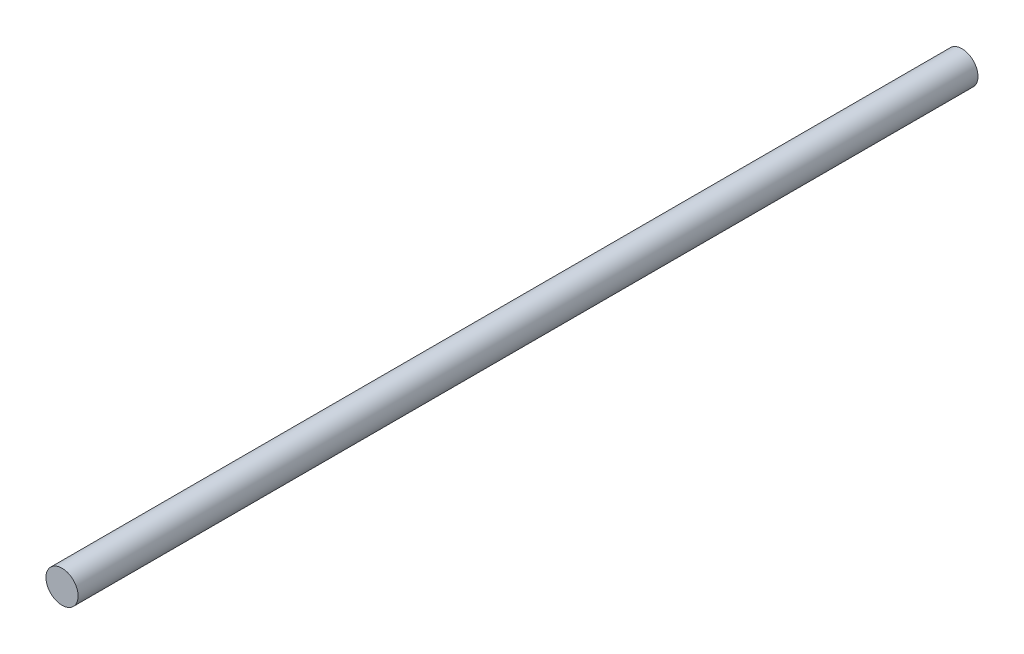
from build123d import *

# Parameters (mm, degrees)
SKETCH1_R           = 6.35
BOSS_EXTRUDE1_DEPTH = 177.8


with BuildPart() as part:
    # Sketch1 → Boss-Extrude1 (new, symmetric)
    with BuildSketch(Plane.XY):
        Circle(SKETCH1_R)
    extrude(amount=BOSS_EXTRUDE1_DEPTH, both=True)


solid = part.part
